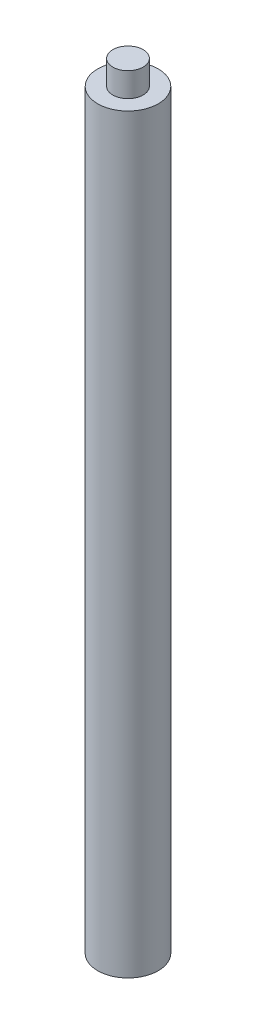
from build123d import *

# Parameters (mm, degrees)
SKETCH1_R           = 10
BOSS_EXTRUDE1_DEPTH = 124
SKETCH2_R           = 5
BOSS_EXTRUDE2_DEPTH = 8


with BuildPart() as part:
    # Sketch1 → Boss-Extrude1 (new, symmetric)
    with BuildSketch(Plane(origin=(0, 0, 0), x_dir=(1, 0, 0), z_dir=(0, 1, 0))):
        with Locations(Location((0, 0, 0), (0, 0, 270))):
            Circle(SKETCH1_R)
    extrude(amount=BOSS_EXTRUDE1_DEPTH, both=True)

    # Sketch2 → Boss-Extrude2 (add)
    with BuildSketch(Plane(origin=(0, 124, 0), x_dir=(1, 0, 0), z_dir=(0, 1, 0))):
        with Locations(Location((0, 0, 0), (0, 0, 270))):
            Circle(SKETCH2_R)
    extrude(amount=BOSS_EXTRUDE2_DEPTH)


solid = part.part
